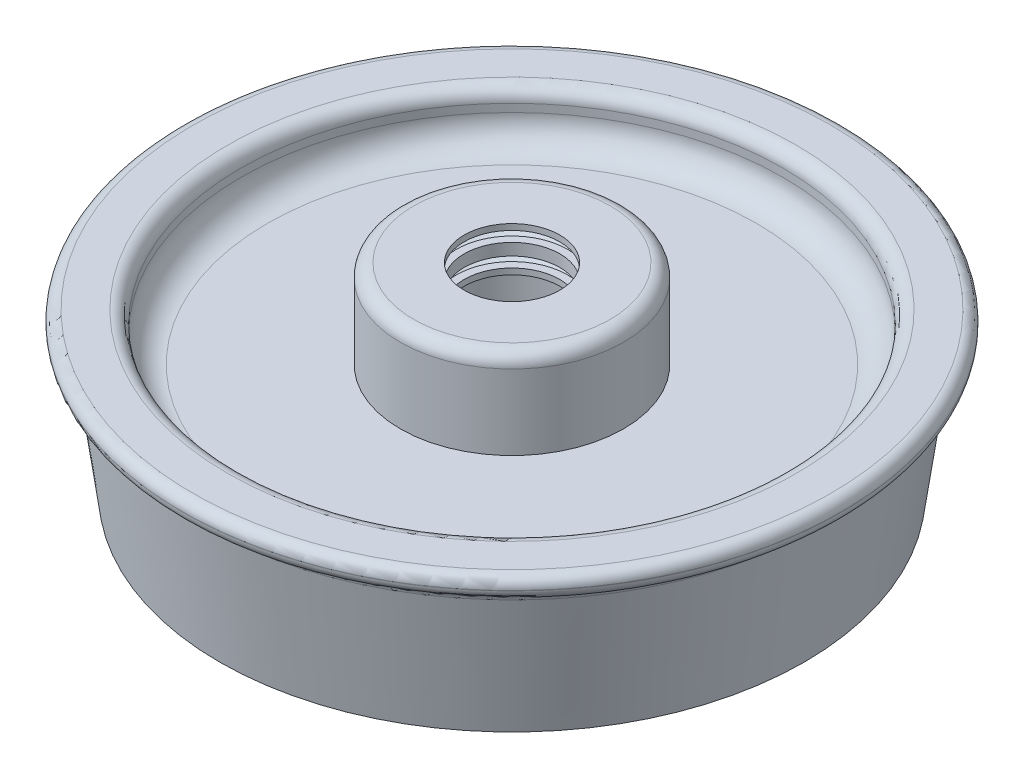
from build123d import *

# Parameters (mm, degrees)
REDONDEO1_R                  = 5
REDONDEO2_R                  = 10
REDONDEO3_R                  = 5
REDONDEO5_R                  = 4
REDONDEO6_R                  = 4
REDONDEO7_R                  = 5
REDONDEO8_R                  = 10
SALIENTE_EXTRUIR2_DEPTH      = 3
SALIENTE_EXTRUIR2_DEPTH_BACK = 3
MATRIZC2_COUNT               = 4


with BuildPart() as part:
    # Croquis1 → Revolución1 (revolve)
    with BuildSketch(Plane.XY):
        Polygon((-102, 42), (-102, 60), (-124, 60), (-124, 52), (-117.181576326, 52), (-110, 0), (-102, 0), (-102, 34), (-42, 34), (-42, 12), (-28, 12), (-28, 58.490984474), (-18, 58.490984474), (-18, 75.195650491), (-42, 75.195650491), (-42, 42), align=None)
    revolve(axis=Axis((0, 0, 0), (0, 1, 0)))

    # Redondeo1
    redondeo1_edges = [part.edges().sort_by_distance(p)[0] for p in [
        (102, 60, 0),
    ]]
    fillet(redondeo1_edges, radius=REDONDEO1_R)

    # Redondeo2
    redondeo2_edges = [part.edges().sort_by_distance(p)[0] for p in [
        (102, 42, 0),
    ]]
    fillet(redondeo2_edges, radius=REDONDEO2_R)

    # Redondeo3
    redondeo3_edges = [part.edges().sort_by_distance(p)[0] for p in [
        (117.181576326, 52, 0),
    ]]
    fillet(redondeo3_edges, radius=REDONDEO3_R)

    # Redondeo5
    redondeo5_edges = [part.edges().sort_by_distance(p)[0] for p in [
        (124, 60, 0),
    ]]
    fillet(redondeo5_edges, radius=REDONDEO5_R)

    # Redondeo6
    redondeo6_edges = [part.edges().sort_by_distance(p)[0] for p in [
        (124, 52, 0),
    ]]
    fillet(redondeo6_edges, radius=REDONDEO6_R)

    # Redondeo7
    redondeo7_edges = [part.edges().sort_by_distance(p)[0] for p in [
        (42, 75.195650491, 0),
    ]]
    fillet(redondeo7_edges, radius=REDONDEO7_R)

    # Redondeo8
    redondeo8_edges = [part.edges().sort_by_distance(p)[0] for p in [
        (102, 34, 0),
    ]]
    fillet(redondeo8_edges, radius=REDONDEO8_R)

    # Croquis3 → Cortar-Revolución1 (revolve, cut)
    with BuildSketch(Plane.XY):
        Polygon((20.918885799, 64.610171286), (24, 63.710761352), (24, 61.710761352), (20.946452265, 60.721797662), (0, 60.721797662), (0, 64.610171286), align=None)
    cortar_revoluci_n1 = revolve(axis=Axis((0, 0, 0), (0, 1, 0)), mode=Mode.SUBTRACT)

    # Simetría1: Cortar-Revolución1 across plane
    add(cortar_revoluci_n1.mirror(Plane(origin=(0, 66.843317483, 0), x_dir=(0, 0, 1), z_dir=(0, -1, 0))), mode=Mode.SUBTRACT)


with BuildPart() as body_2:
    # Croquis4 → Saliente-Extruir2 (new, two sides: drawn at the far end of the back side and taken through both)
    with BuildSketch(Plane.XY.offset(-SALIENTE_EXTRUIR2_DEPTH_BACK)):
        Polygon((42, 34), (42, 24), (88.899460504, 34), align=None)
    extrude(amount=SALIENTE_EXTRUIR2_DEPTH + SALIENTE_EXTRUIR2_DEPTH_BACK)


with BuildPart() as matrizc2_1:
    # MatrizC2: pattern copy
    add(body_2.part.rotate(Axis((0, 34, 0), (0, -1, 0)), 1 * 360 / MATRIZC2_COUNT))


with BuildPart() as matrizc2_2:
    # MatrizC2: pattern copy
    add(body_2.part.rotate(Axis((0, 34, 0), (0, -1, 0)), 2 * 360 / MATRIZC2_COUNT))


with BuildPart() as matrizc2_3:
    # MatrizC2: pattern copy
    add(body_2.part.rotate(Axis((0, 34, 0), (0, -1, 0)), 3 * 360 / MATRIZC2_COUNT))


solid = Compound([part.part, body_2.part, matrizc2_1.part, matrizc2_2.part, matrizc2_3.part])
